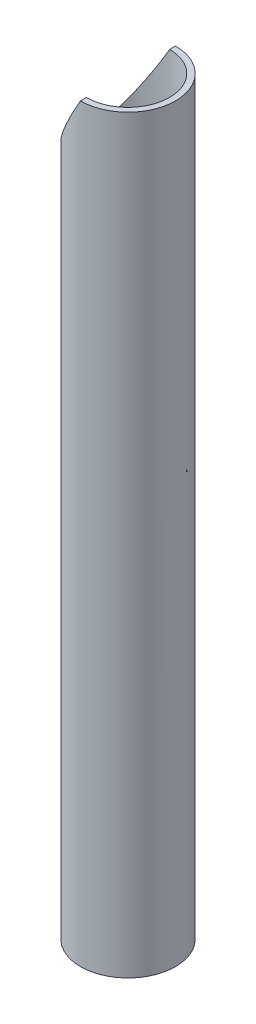
from build123d import *

# Parameters (mm, degrees)
SKETCH1_R               = 8
SKETCH1_R_2             = 7
BOSS_EXTRUDE1_DEPTH     = 126.216017178
CUT_EXTRUDE1_DEPTH      = 25
CUT_EXTRUDE1_DEPTH_BACK = 25


with BuildPart() as part:
    # Sketch1 → Boss-Extrude1 (new body)
    with BuildSketch(Plane(origin=(0, 0, 0), x_dir=(1, 0, 0), z_dir=(0, 1, 0))):
        Circle(SKETCH1_R)
        Circle(SKETCH1_R_2, mode=Mode.SUBTRACT)
    extrude(amount=BOSS_EXTRUDE1_DEPTH)

    # Sketch2 → Cut-Extrude1 (cut, two sides: drawn at the far end of the back side and taken through both)
    with BuildSketch(Plane.XY.offset(-CUT_EXTRUDE1_DEPTH_BACK)):
        Polygon((0, 126.216017178), (-8, 112.359610717), (-8, 126.216017178), align=None)
    extrude(amount=CUT_EXTRUDE1_DEPTH + CUT_EXTRUDE1_DEPTH_BACK, mode=Mode.SUBTRACT)


solid = part.part
